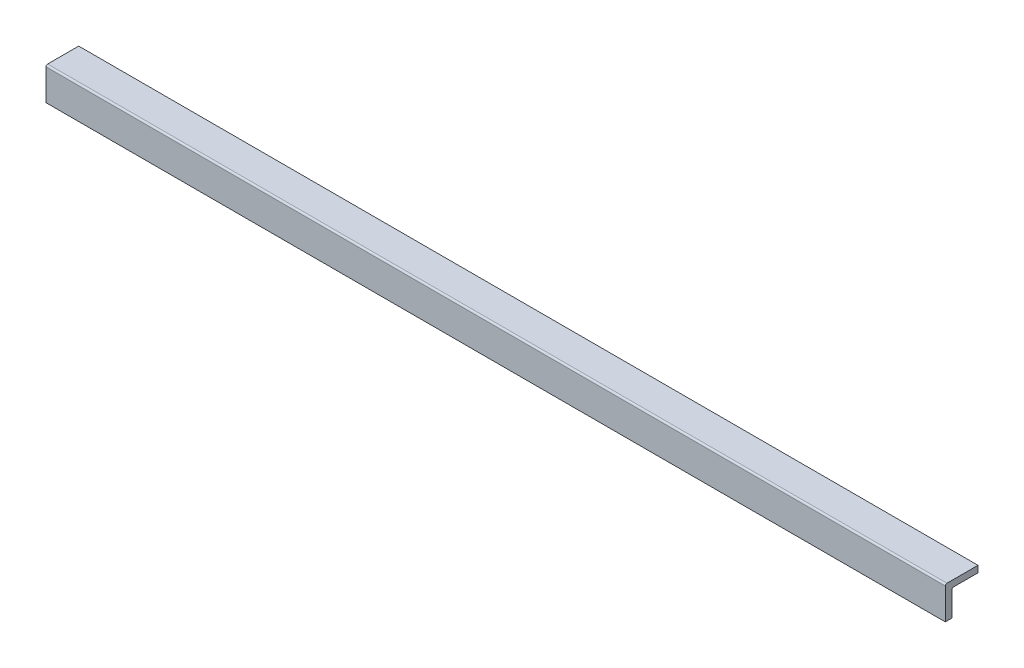
from build123d import *

# Parameters (mm, degrees)
BOSS_EXTRUDE1_DEPTH      = 137.5
BOSS_EXTRUDE1_DEPTH_BACK = 137.5


with BuildPart() as part:
    # Sketch1 → Boss-Extrude1 (new, two sides: drawn at the far end of the back side and taken through both)
    with BuildSketch(Plane(origin=(0, 0, 0), x_dir=(0, 0, -1), z_dir=(1, 0, 0)).offset(-BOSS_EXTRUDE1_DEPTH_BACK)):
        with BuildLine():
            Line((0, -10), (0, -0.5))
            ThreePointArc((0, -0.5), (0.146446609, -0.146446609), (0.5, 0))
            Line((0.5, 0), (10, 0))
            Line((10, 0), (10, -2))
            Line((10, -2), (2.5, -2))
            ThreePointArc((2.5, -2), (2.146446609, -2.146446609), (2, -2.5))
            Line((2, -2.5), (2, -10))
            Line((2, -10), (0, -10))
        make_face()
    extrude(amount=BOSS_EXTRUDE1_DEPTH + BOSS_EXTRUDE1_DEPTH_BACK)


solid = part.part
